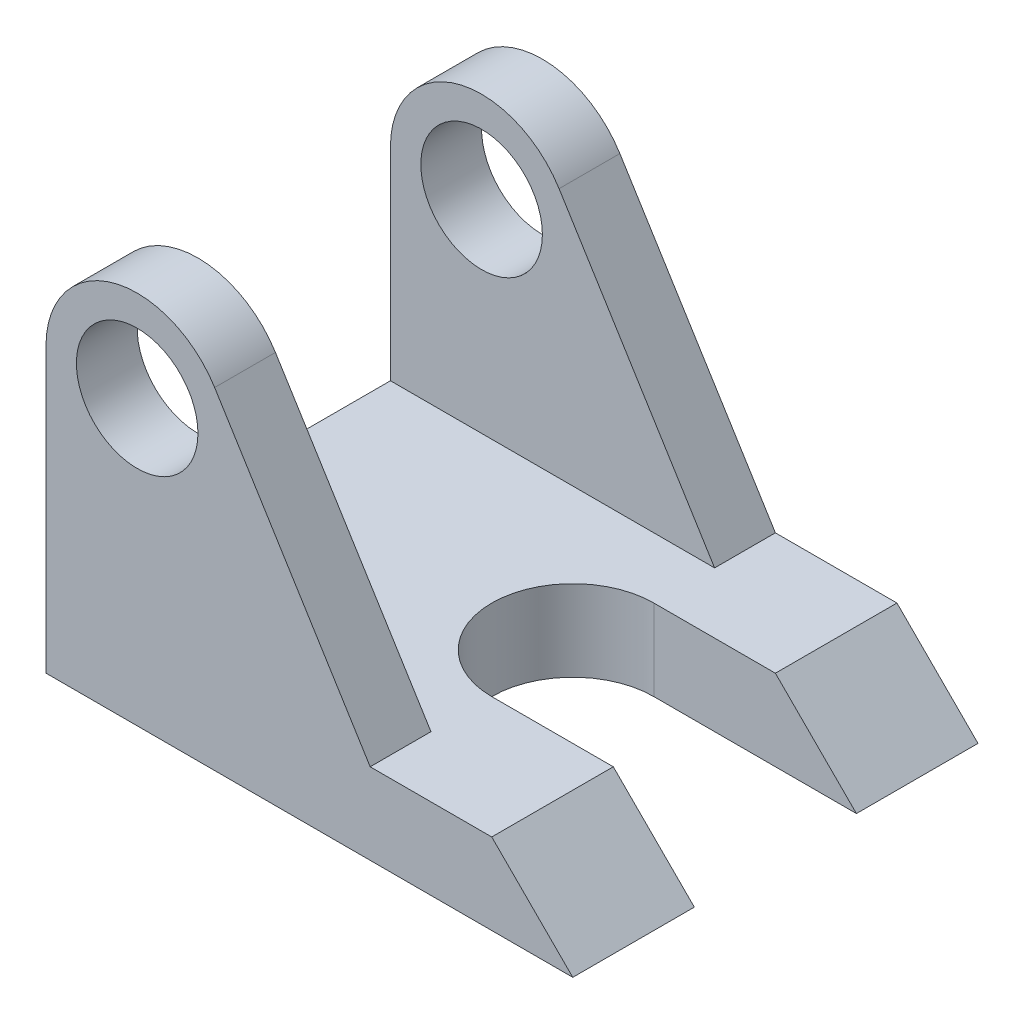
from build123d import *

# Parameters (mm, degrees)
BOSS_EXTRUDE1_DEPTH     = 50
BOSS_EXTRUDE2_START     = -35
SKETCH1_3_R             = 15
BOSS_EXTRUDE2_DEPTH     = 15
CUT_EXTRUDE1_DEPTH      = 168.201226072
CUT_EXTRUDE1_DEPTH_BACK = 168.201226072


with BuildPart() as part:
    # Sketch1 → Boss-Extrude1 (new, symmetric)
    with BuildSketch(Plane.XY):
        Polygon((80, 20), (0, 20), (0, 0), (130, 0), (110, 20), align=None)
    extrude(amount=BOSS_EXTRUDE1_DEPTH, both=True)

    # Sketch1<3> → Boss-Extrude2 (add)
    with BuildSketch(Plane.XY.offset(BOSS_EXTRUDE2_START)):
        with BuildLine():
            Line((0, 70), (0, 20))
            Line((0, 20), (80, 20))
            Line((80, 20), (41.61915802, 81.862031723))
            ThreePointArc((41.61915802, 81.862031723), (16.33279056, 91.638288466), (0, 70))
        make_face()
        with Locations((22.5, 70)):
            Circle(SKETCH1_3_R, mode=Mode.SUBTRACT)
    boss_extrude2 = extrude(amount=-BOSS_EXTRUDE2_DEPTH)

    # Mirror2: Boss-Extrude2 across plane
    add(boss_extrude2.mirror(Plane.XY))

    # Sketch2 → Cut-Extrude1 (cut, two sides: drawn at the far end of the back side and taken through both)
    with BuildSketch(Plane(origin=(0, 0, 0), x_dir=(1, 0, 0), z_dir=(0, 1, 0)).offset(-CUT_EXTRUDE1_DEPTH_BACK)):
        with BuildLine():
            Line((130, 20), (80, 20))
            ThreePointArc((80, 20), (60, 0), (80, -20))
            Line((80, -20), (130, -20))
            Line((130, -20), (130, 20))
        make_face()
    extrude(amount=CUT_EXTRUDE1_DEPTH + CUT_EXTRUDE1_DEPTH_BACK, mode=Mode.SUBTRACT)


solid = part.part
